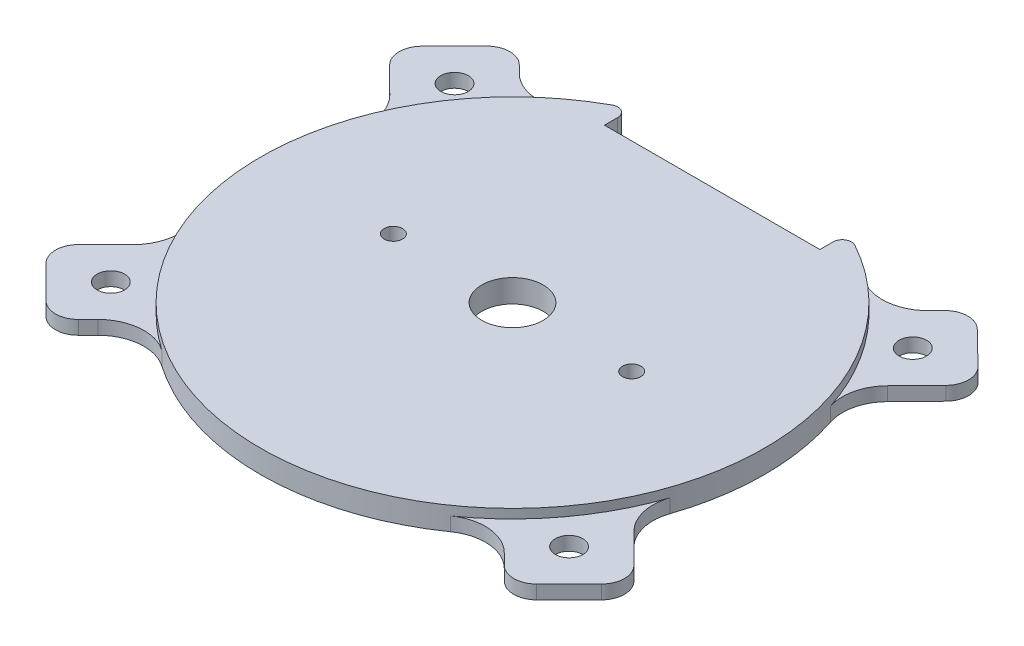
from build123d import *

# Parameters (mm, degrees)
SKETCH_1_R          = 55
EXTRUDE_1_DEPTH     = 5
SKETCH_5_W          = 47
SKETCH_5_H          = 12.24289715
CUT_EXTRUDE_2_DEPTH = 30
FILLET_4_R          = 2
FILLET_5_R          = 2
EXTRUDE_START       = -3
EXTRUDE_3_DEPTH     = 3
FILLET_7_R          = 10
FILLET_8_R          = 5
SKETCH_10_R         = 3
CUT_EXTRUDE_5_DEPTH = 3
SKETCH_15_R         = 6.7
CUT_EXTRUDE_6_DEPTH = 10
SKETCH_16_R         = 2
CUT_EXTRUDE_7_DEPTH = 10


with BuildPart() as part:
    # 草图1 → 凸台-拉伸1 (new body)
    with BuildSketch(Plane(origin=(0, 0, 0), x_dir=(1, 0, 0), z_dir=(0, 1, 0))):
        with Locations(Location((0, 0, 0), (0, 0, 270))):
            Circle(SKETCH_1_R)
    extrude(amount=EXTRUDE_1_DEPTH)

    # 草图5 → 切除-拉伸2 (cut)
    with BuildSketch(Plane(origin=(0, 5, 0), x_dir=(1, 0, 0), z_dir=(0, 1, 0))):
        with Locations((0, 49.687490397)):
            Rectangle(SKETCH_5_W, SKETCH_5_H)
    extrude(amount=-CUT_EXTRUDE_2_DEPTH, mode=Mode.SUBTRACT)

    # 圆角4
    fillet_4_edges = [part.edges().sort_by_distance(p)[0] for p in [
        (-23.5, 2.5, -49.726753363),
    ]]
    fillet(fillet_4_edges, radius=FILLET_4_R)

    # 圆角5
    fillet_5_edges = [part.edges().sort_by_distance(p)[0] for p in [
        (23.5, 2.5, -49.726753363),
    ]]
    fillet(fillet_5_edges, radius=FILLET_5_R)

    # 草图14 → 凸台-拉伸3 (add)
    with BuildSketch(Plane(origin=(0, 3, 0), x_dir=(1, 0, 0), z_dir=(0, 1, 0)).offset(EXTRUDE_START)):
        with BuildLine():
            Line((-49.898576095, 23.132922507), (-63.862525635, 37.044772973))
            Line((-63.862525635, 37.044772973), (-49.746845912, 51.213315099))
            Line((-49.746845912, 51.213315099), (-38.128637352, 39.638453724))
            ThreePointArc((-38.128637352, 39.638453724), (-44.78063998, 31.932652301), (-49.898576095, 23.132922507))
        make_face()
        with BuildLine():
            Line((49.811900188, -23.3189751), (64.421720913, -37.928795825))
            Line((64.421720913, -37.928795825), (50.279585289, -52.070931449))
            Line((50.279585289, -52.070931449), (37.984884655, -39.776230814))
            ThreePointArc((37.984884655, -39.776230814), (44.662950793, -32.097053236), (49.811900188, -23.3189751))
        make_face()
        with BuildLine():
            Line((-49.632393674, -23.698639164), (-63.862550335, -37.928795825))
            Line((-63.862550335, -37.928795825), (-49.720414711, -52.070931449))
            Line((-49.720414711, -52.070931449), (-37.697852746, -40.048369484))
            ThreePointArc((-37.697852746, -40.048369484), (-44.423770724, -32.427281642), (-49.632393674, -23.698639164))
        make_face()
        with BuildLine():
            Line((38.475737251, 39.301623923), (50.118901666, 51.212426922))
            Line((50.118901666, 51.212426922), (64.420808036, 37.231887798))
            Line((64.420808036, 37.231887798), (50.134465219, 22.6171483))
            ThreePointArc((50.134465219, 22.6171483), (45.083643676, 31.50341367), (38.475737251, 39.301623923))
        make_face()
    extrude(amount=EXTRUDE_3_DEPTH)

    # 圆角7
    fillet_7_edges = [part.edges().sort_by_distance(p)[0] for p in [
        (-38.128637352, 1.5, -39.638453724),
        (-49.898576095, 1.5, -23.132922507),
        (-49.632393674, 1.5, 23.698639164),
        (-37.697852746, 1.5, 40.048369484),
        (50.134465219, 1.5, -22.6171483),
        (38.475737251, 1.5, -39.301623923),
        (37.984884655, 1.5, 39.776230814),
        (49.811900188, 1.5, 23.3189751),
    ]]
    fillet(fillet_7_edges, radius=FILLET_7_R)

    # 圆角8
    fillet_8_edges = [part.edges().sort_by_distance(p)[0] for p in [
        (-63.862525635, 1.5, -37.044772973),
        (-49.746845912, 1.5, -51.213315099),
        (-49.720414711, 1.5, 52.070931449),
        (-63.862550335, 1.5, 37.928795825),
        (50.118901666, 1.5, -51.212426922),
        (64.420808036, 1.5, -37.231887798),
        (50.279585289, 1.5, 52.070931449),
        (64.421720913, 1.5, 37.928795825),
    ]]
    fillet(fillet_8_edges, radius=FILLET_8_R)

    # 草图10 → 切除-拉伸5 (cut)
    with BuildSketch(Plane(origin=(0, 3, 0), x_dir=(1, 0, 0), z_dir=(0, 1, 0))):
        with Locations(Location((-49.720414711, 37.071204175, 0), (0, 0, 270))):
            Circle(SKETCH_10_R)
        with Locations(Location((50.279585289, 37.071204175, 0), (0, 0, 270))):
            Circle(SKETCH_10_R)
        with Locations(Location((-49.720414711, -37.928795825, 0), (0, 0, 270))):
            Circle(SKETCH_10_R)
        with Locations(Location((50.279585289, -37.928795825, 0), (0, 0, 270))):
            Circle(SKETCH_10_R)
    extrude(amount=-CUT_EXTRUDE_5_DEPTH, mode=Mode.SUBTRACT)

    # 草图15 → 切除-拉伸6 (cut)
    with BuildSketch(Plane(origin=(0, 5, 0), x_dir=(1, 0, 0), z_dir=(0, 1, 0))):
        with Locations(Location((0, 0, 0), (0, 0, 270))):
            Circle(SKETCH_15_R)
    extrude(amount=-CUT_EXTRUDE_6_DEPTH, mode=Mode.SUBTRACT)

    # 草图16 → 切除-拉伸7 (cut)
    with BuildSketch(Plane(origin=(0, 5, 0), x_dir=(1, 0, 0), z_dir=(0, 1, 0))):
        with Locations(Location((-26, 0, 0), (0, 0, 270))):
            Circle(SKETCH_16_R)
        with Locations(Location((26, 0, 0), (0, 0, 270))):
            Circle(SKETCH_16_R)
    extrude(amount=-CUT_EXTRUDE_7_DEPTH, mode=Mode.SUBTRACT)


solid = part.part
